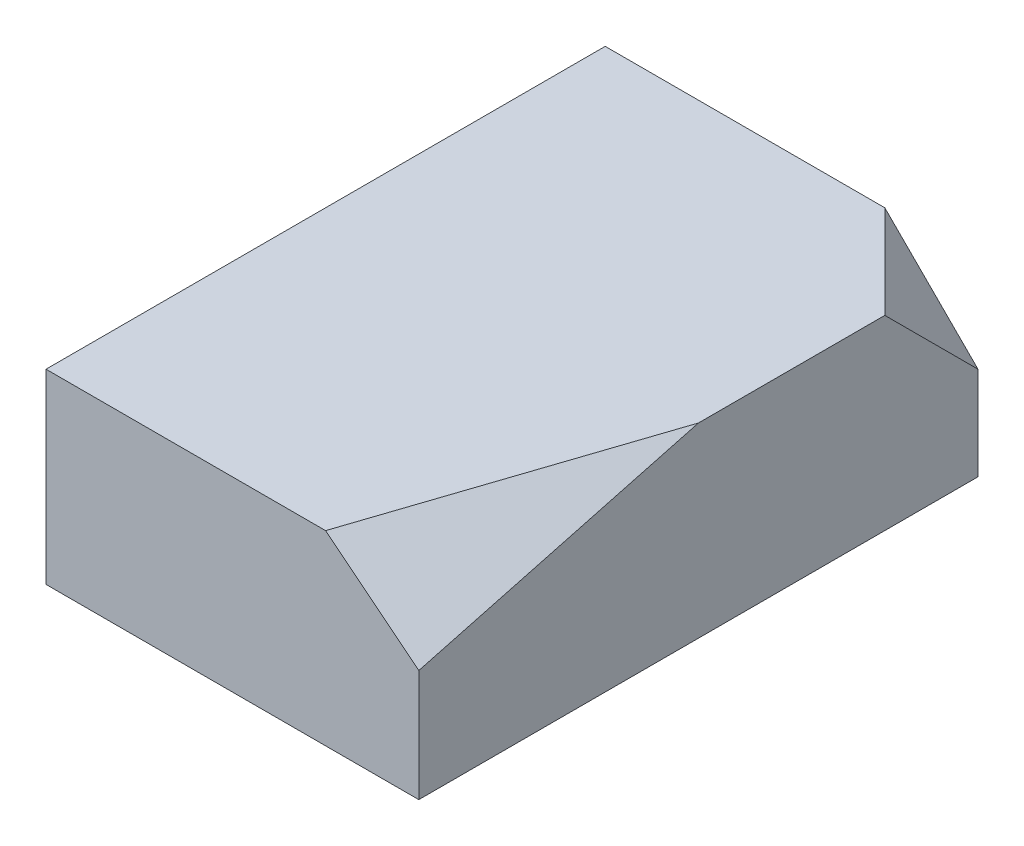
from build123d import *

# Parameters (mm, degrees)
SKETCH1_W           = 101.6
SKETCH1_H           = 152.4
BOSS_EXTRUDE2_DEPTH = 50.8
CUT_EXTRUDE1_DEPTH  = 141.672729153
CUT_EXTRUDE2_DEPTH  = 171.388379885


with BuildPart() as part:
    # Sketch1 → Boss-Extrude2 (new body)
    with BuildSketch(Plane(origin=(0, 0, 0), x_dir=(1, 0, 0), z_dir=(0, 1, 0))):
        Rectangle(SKETCH1_W, SKETCH1_H)
    extrude(amount=BOSS_EXTRUDE2_DEPTH)

    # Sketch5 → Cut-Extrude1 (cut, through all)
    with BuildSketch(Plane(origin=(42.751168831, 53.438961039, 14.25038961), x_dir=(0.7911852033335972, -0.5909267078840152, -0.15758045543573734), z_dir=(0.6115766297251511, 0.764470787156438, 0.20385887657505006))):
        Polygon((-21.9306033, -60.537839749), (10.173131569, 13.089262648), (10.173131569, -65.773544809), align=None)
    extrude(amount=CUT_EXTRUDE1_DEPTH, mode=Mode.SUBTRACT)

    # Sketch7 → Cut-Extrude2 (cut, through all)
    with BuildSketch(Plane(origin=(50.8, 50.8, -50.8), x_dir=(0.8164965809277263, -0.40824829046386296, 0.40824829046386296), z_dir=(-0.5773502691896256, -0.5773502691896258, 0.5773502691896258))):
        Polygon((0, 0), (0, -35.921024484), (-31.108519733, -17.960512242), align=None)
    extrude(amount=-CUT_EXTRUDE2_DEPTH, mode=Mode.SUBTRACT)


solid = part.part
